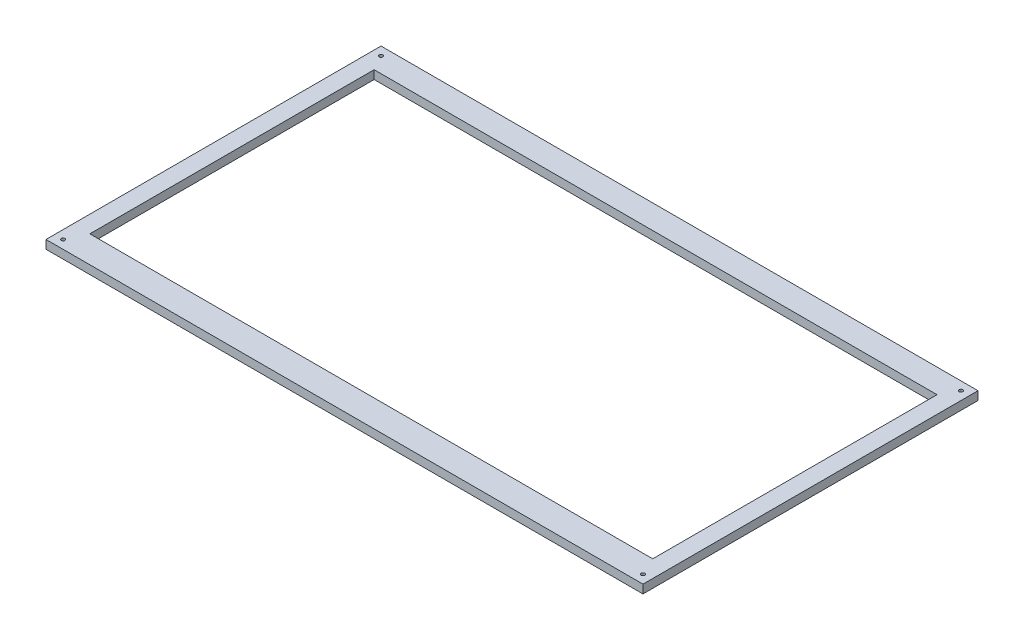
from build123d import *

# Parameters (mm, degrees)
SKETCH1_W           = 2100
SKETCH1_H           = 1178.5
SKETCH1_W_2         = 1980
SKETCH1_H_2         = 1000
BOSS_EXTRUDE1_DEPTH = 30
SKETCH2_R           = 6.35
CUT_EXTRUDE1_DEPTH  = 1205.415029174


with BuildPart() as part:
    # Sketch1 → Boss-Extrude1 (new body)
    with BuildSketch(Plane(origin=(0, 0, 0), x_dir=(1, 0, 0), z_dir=(0, 1, 0))):
        Rectangle(SKETCH1_W, SKETCH1_H)
        with Locations((0, 5)):
            Rectangle(SKETCH1_W_2, SKETCH1_H_2, mode=Mode.SUBTRACT)
    extrude(amount=-BOSS_EXTRUDE1_DEPTH)

    # Sketch2 → Cut-Extrude1 (cut, through all)
    with BuildSketch(Plane(origin=(0, 0, 0), x_dir=(1, 0, 0), z_dir=(0, 1, 0))):
        with Locations(Location((-1020, 559.25, 0), (0, 0, 270))):
            Circle(SKETCH2_R)
        with Locations(Location((-1020, -559.25, 0), (0, 0, 270))):
            Circle(SKETCH2_R)
        with Locations(Location((1020, 559.25, 0), (0, 0, 270))):
            Circle(SKETCH2_R)
        with Locations(Location((1020, -559.25, 0), (0, 0, 270))):
            Circle(SKETCH2_R)
    extrude(amount=-CUT_EXTRUDE1_DEPTH, mode=Mode.SUBTRACT)


solid = part.part
